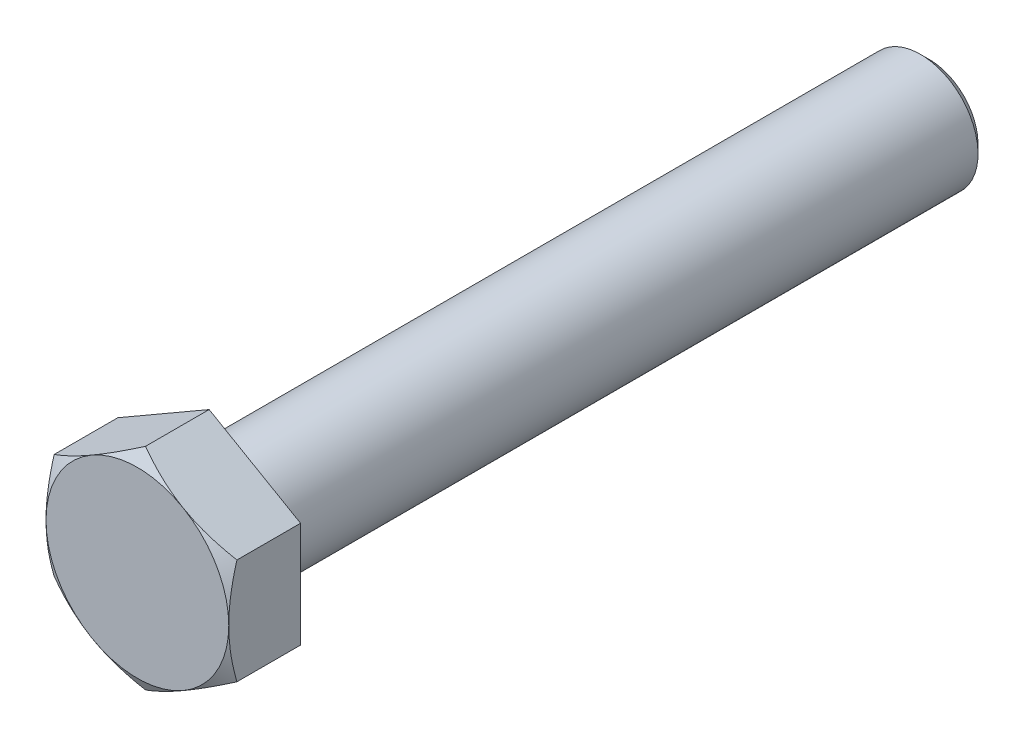
from build123d import *

# Parameters (mm, degrees)
BOSS_EXTRUDE1_DEPTH = 5.15


with BuildPart() as part:
    # Sketch1 → Boss-Extrude1 (new body)
    with BuildSketch(Plane.XY):
        Polygon((0, 7.349668927), (-6.365, 3.674834463), (-6.365, -3.674834463), (0, -7.349668927), (6.365, -3.674834463), (6.365, 3.674834463), align=None)
    extrude(amount=BOSS_EXTRUDE1_DEPTH)

    # Sketch2 → Revolve1 (revolve)
    with BuildSketch(Plane(origin=(0, 0, 0), x_dir=(0, 0, -1), z_dir=(1, 0, 0)), mode=Mode.PRIVATE) as revolve1_sk:
        with BuildLine():
            Line((0, 0), (0, 4.6))
            ThreePointArc((0, 4.6), (0.175735931, 4.175735931), (0.6, 4))
            Line((0.6, 4), (49.4, 4))
            Line((49.4, 4), (50, 3.4))
            Line((50, 3.4), (50, 0))
            Line((50, 0), (0, 0))
        make_face()
    revolve(revolve1_sk.sketch.rotate(Axis((0, 0, 0), (0, 0, -1)), 180), axis=Axis((0, 0, 0), (0, 0, -1)))

    # Sketch3 → Cut-Revolve1 (revolve, cut)
    with BuildSketch(Plane(origin=(0, 0, 0), x_dir=(0, 0, -1), z_dir=(1, 0, 0)), mode=Mode.PRIVATE) as cut_revolve1_sk:
        Polygon((-5.15, 7.349668927), (-4.58150113, 7.349668927), (-5.15, 6.365), align=None)
        Polygon((-0.15, 7.349668927), (-0.15, 5.88660254), (0, 5.8), (0, 7.349668927), align=None)
    revolve(cut_revolve1_sk.sketch.rotate(Axis((0, 0, 12.204941078), (0, 0, -1)), 90), axis=Axis((0, 0, 12.204941078), (0, 0, -1)), mode=Mode.SUBTRACT)


solid = part.part
